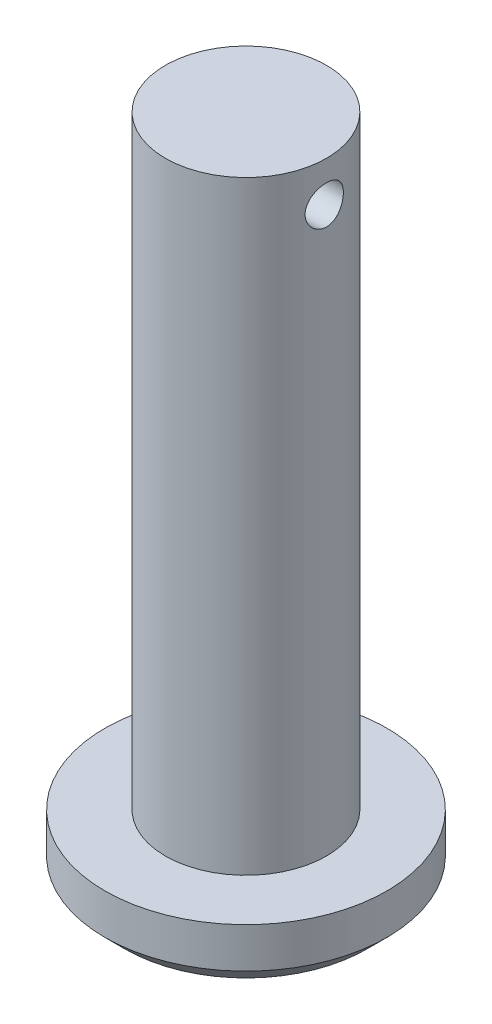
from build123d import *

# Parameters (mm, degrees)
SKETCH1_R           = 7
BOSS_EXTRUDE1_DEPTH = 3
SKETCH1_3_R         = 4
BOSS_EXTRUDE2_DEPTH = 30
CHAMFER1_SIZE       = 1
CUT_EXTRUDE1_REACH  = 34.711
SKETCH2_R           = 0.95


with BuildPart() as part:
    # Sketch1 → Boss-Extrude1 (new body)
    with BuildSketch(Plane(origin=(0, 0, 0), x_dir=(1, 0, 0), z_dir=(0, 1, 0))):
        Circle(SKETCH1_R)
    extrude(amount=-BOSS_EXTRUDE1_DEPTH)

    # Sketch1<3> → Boss-Extrude2 (add)
    with BuildSketch(Plane(origin=(0, 0, 0), x_dir=(1, 0, 0), z_dir=(0, 1, 0))):
        Circle(SKETCH1_3_R)
    extrude(amount=BOSS_EXTRUDE2_DEPTH)

    # Chamfer1
    chamfer1_edges = [part.edges().sort_by_distance(p)[0] for p in [
        (-7, -3, 0),
    ]]
    chamfer(chamfer1_edges, length=CHAMFER1_SIZE)

    # Sketch2 → Cut-Extrude1 (cut, up to next)
    with BuildSketch(Plane.ZY.offset(4), mode=Mode.PRIVATE) as cut_extrude1_sk1:
        with Locations((0, 28)):
            Circle(SKETCH2_R)
    cut_extrude1_tool1 = extrude(cut_extrude1_sk1.sketch, amount=-CUT_EXTRUDE1_REACH, mode=Mode.PRIVATE) & part.part
    add(cut_extrude1_tool1.solids().sort_by_distance((-4, 28, 0))[0], mode=Mode.SUBTRACT)


solid = part.part
